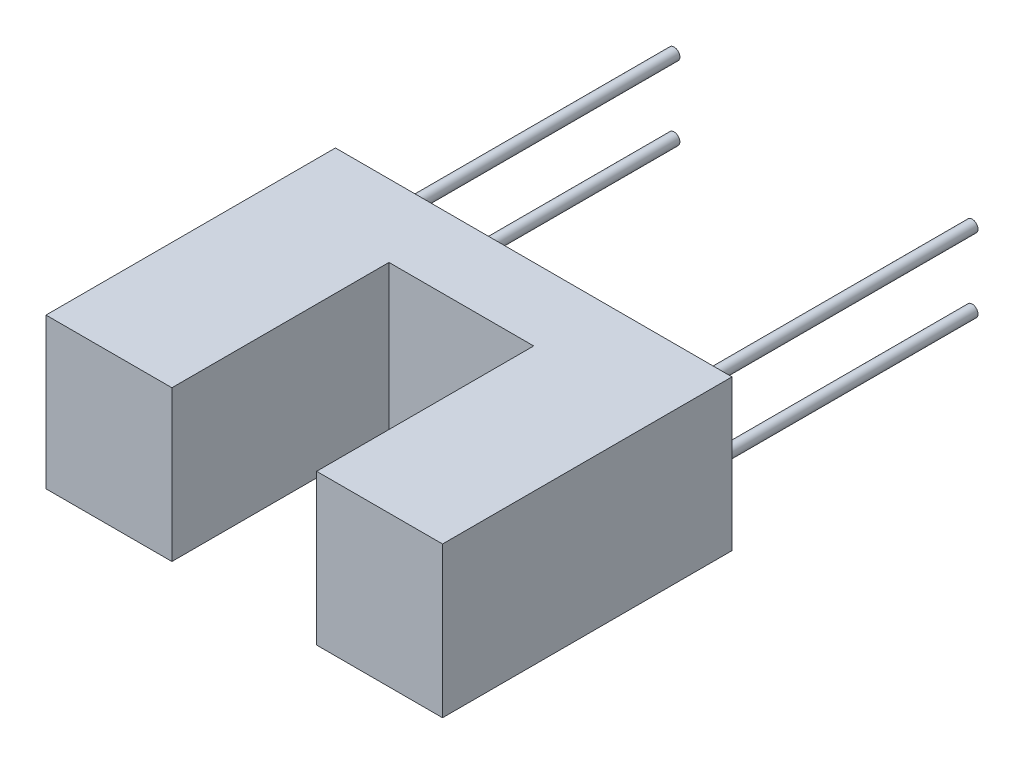
from build123d import *

# Parameters (mm, degrees)
SKETCH1_W           = 13.7
SKETCH1_H           = 10
BOSS_EXTRUDE1_DEPTH = 5.2
SKETCH2_W           = 5
SKETCH2_H           = 7.5
CUT_EXTRUDE1_DEPTH  = 10.947989747
SKETCH3_R           = 0.2
BOSS_EXTRUDE2_DEPTH = 10


with BuildPart() as part:
    # Sketch1 → Boss-Extrude1 (new body)
    with BuildSketch(Plane(origin=(0, 0, 0), x_dir=(1, 0, 0), z_dir=(0, 1, 0))):
        Rectangle(SKETCH1_W, SKETCH1_H)
    extrude(amount=BOSS_EXTRUDE1_DEPTH)

    # Sketch2 → Cut-Extrude1 (cut, through all)
    with BuildSketch(Plane.XZ):
        with Locations((0, 1.25)):
            Rectangle(SKETCH2_W, SKETCH2_H)
    extrude(amount=-CUT_EXTRUDE1_DEPTH, mode=Mode.SUBTRACT)

    # Sketch3 → Boss-Extrude2 (add)
    with BuildSketch(Plane(origin=(0, 0, -5), x_dir=(-1, 0, 0), z_dir=(0, 0, -1))):
        with Locations(Location((-5.15, 3.87, 0), (0, 0, 180))):
            Circle(SKETCH3_R)
        with Locations(Location((-5.15, 1.33, 0), (0, 0, 180))):
            Circle(SKETCH3_R)
        with Locations(Location((5.15, 3.87, 0), (0, 0, 180))):
            Circle(SKETCH3_R)
        with Locations(Location((5.15, 1.33, 0), (0, 0, 180))):
            Circle(SKETCH3_R)
    extrude(amount=BOSS_EXTRUDE2_DEPTH)


solid = part.part
